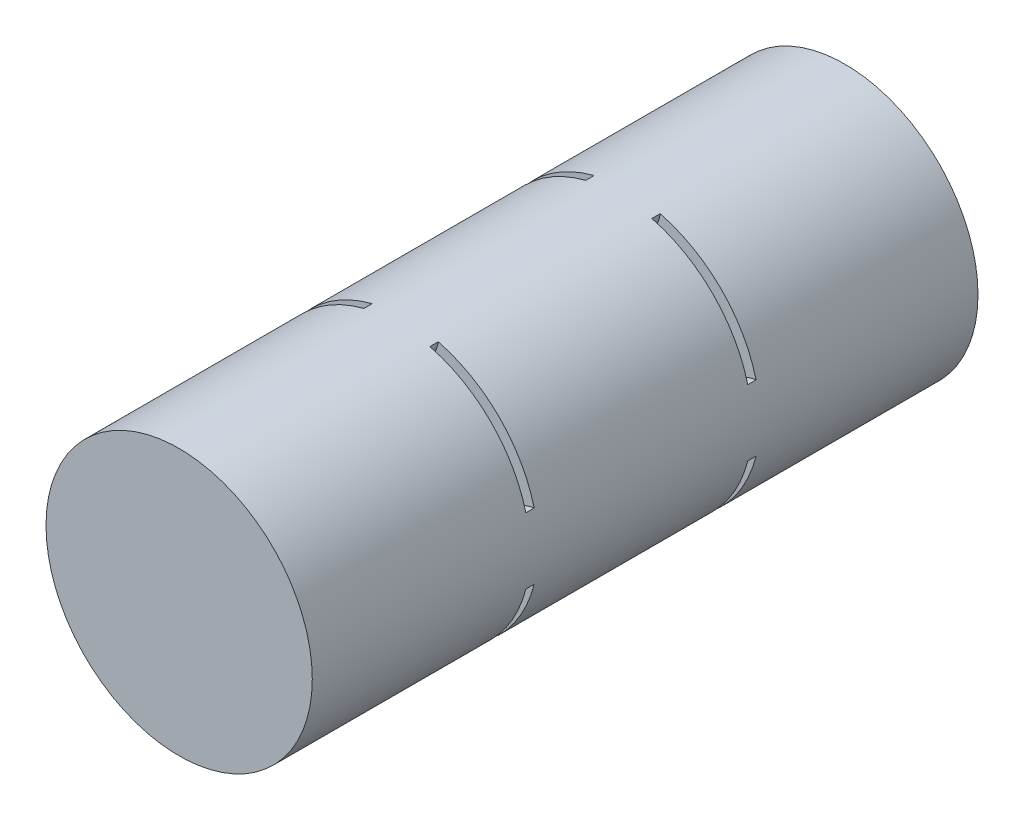
from build123d import *

# Parameters (mm, degrees)
SKETCH1_R           = 50.8
BOSS_EXTRUDE1_DEPTH = 254
CUT_EXTRUDE1_START  = -86.25332
SKETCH2_R           = 19.05
CUT_EXTRUDE1_DEPTH  = 3.175
CUT_EXTRUDE2_START  = 83.07832
SKETCH4_R           = 19.05
CUT_EXTRUDE2_DEPTH  = 3.175


with BuildPart() as part:
    # Sketch1 → Boss-Extrude1 (new body)
    with BuildSketch(Plane.XY):
        Circle(SKETCH1_R)
    extrude(amount=BOSS_EXTRUDE1_DEPTH)

    # Sketch2 → Cut-Extrude1 (cut)
    with BuildSketch(Plane.XY.offset(254).offset(CUT_EXTRUDE1_START)):
        with BuildLine():
            ThreePointArc((-12.600390619, 49.2125), (-35.921024484, 35.921024484), (-49.2125, 12.600390619))
            ThreePointArc((-49.2125, 12.600390619), (-38.1, 0), (-49.2125, -12.600390619))
            ThreePointArc((-49.2125, -12.600390619), (-35.921024484, -35.921024484), (-12.600390619, -49.2125))
            ThreePointArc((-12.600390619, -49.2125), (0, -38.1), (12.600390619, -49.2125))
            ThreePointArc((12.600390619, -49.2125), (35.921024484, -35.921024484), (49.2125, -12.600390619))
            ThreePointArc((49.2125, -12.600390619), (38.1, 0), (49.2125, 12.600390619))
            ThreePointArc((49.2125, 12.600390619), (35.921024484, 35.921024484), (12.600390619, 49.2125))
            ThreePointArc((12.600390619, 49.2125), (0, 38.1), (-12.600390619, 49.2125))
        make_face()
        Circle(SKETCH2_R, mode=Mode.SUBTRACT)
    extrude(amount=CUT_EXTRUDE1_DEPTH, mode=Mode.SUBTRACT)

    # Sketch4 → Cut-Extrude2 (cut)
    with BuildSketch(Plane.XY.offset(CUT_EXTRUDE2_START)):
        with BuildLine():
            ThreePointArc((-12.600390619, 49.2125), (-35.921024484, 35.921024484), (-49.2125, 12.600390619))
            ThreePointArc((-49.2125, 12.600390619), (-38.1, 0), (-49.2125, -12.600390619))
            ThreePointArc((-49.2125, -12.600390619), (-35.921024484, -35.921024484), (-12.600390619, -49.2125))
            ThreePointArc((-12.600390619, -49.2125), (0, -38.1), (12.600390619, -49.2125))
            ThreePointArc((12.600390619, -49.2125), (35.921024484, -35.921024484), (49.2125, -12.600390619))
            ThreePointArc((49.2125, -12.600390619), (38.1, 0), (49.2125, 12.600390619))
            ThreePointArc((49.2125, 12.600390619), (35.921024484, 35.921024484), (12.600390619, 49.2125))
            ThreePointArc((12.600390619, 49.2125), (0, 38.1), (-12.600390619, 49.2125))
        make_face()
        Circle(SKETCH4_R, mode=Mode.SUBTRACT)
    extrude(amount=CUT_EXTRUDE2_DEPTH, mode=Mode.SUBTRACT)


solid = part.part
